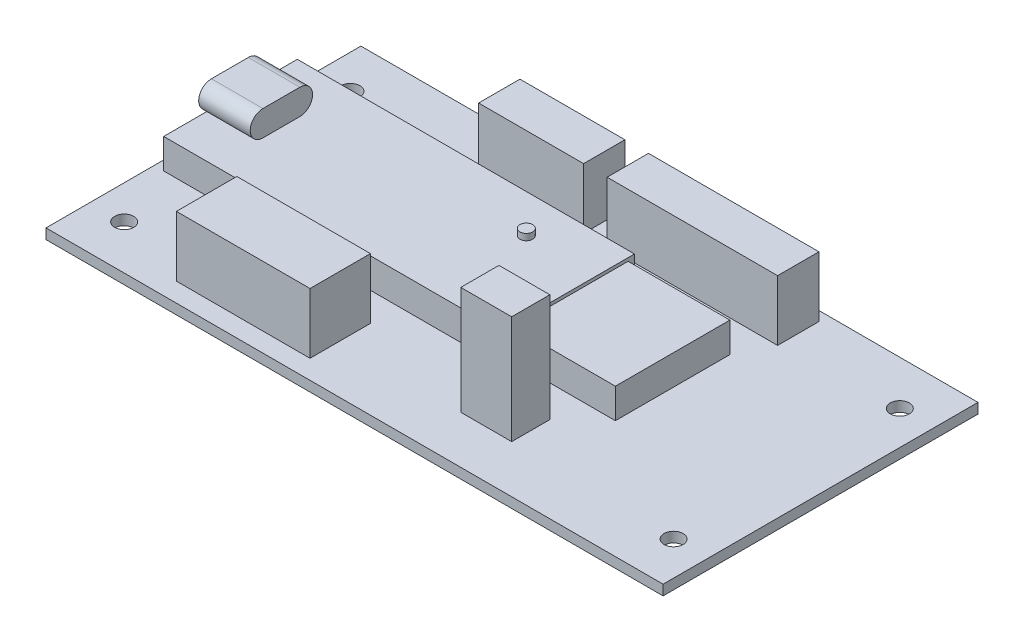
from build123d import *

# Parameters (mm, degrees)
SKETCH1_W                = 97
SKETCH1_H                = 49.5
SKETCH1_R                = 1.5
BOSS_EXTRUDE1_DEPTH      = 1.6
SKETCH2_W                = 16.5
SKETCH2_H                = 6.5
SKETCH2_W_2              = 26.8
SKETCH2_W_3              = 21
SKETCH2_H_2              = 9.5
BOSS_EXTRUDE2_DEPTH      = 9.5
SKETCH2_3_W              = 16
SKETCH2_3_H              = 18
SKETCH2_3_W_2            = 53
SKETCH2_3_H_2            = 21
BOSS_EXTRUDE3_DEPTH      = 4.7
SKETCH2_4_W              = 8
SKETCH2_4_H              = 6
BOSS_EXTRUDE4_DEPTH      = 17
SKETCH3_R                = 1
BOSS_EXTRUDE5_DEPTH      = 1
BOSS_EXTRUDE6_DEPTH      = 0.1
BOSS_EXTRUDE6_DEPTH_BACK = 8


with BuildPart() as part:
    # Sketch1 → Boss-Extrude1 (new body)
    with BuildSketch(Plane(origin=(0, 0, 0), x_dir=(1, 0, 0), z_dir=(0, 1, 0))):
        Rectangle(SKETCH1_W, SKETCH1_H)
        with Locations((-43.18, 17.78)):
            Circle(SKETCH1_R, mode=Mode.SUBTRACT)
        with Locations((-43.18, -17.78)):
            Circle(SKETCH1_R, mode=Mode.SUBTRACT)
        with Locations((43.18, 17.78)):
            Circle(SKETCH1_R, mode=Mode.SUBTRACT)
        with Locations((43.18, -17.78)):
            Circle(SKETCH1_R, mode=Mode.SUBTRACT)
    extrude(amount=BOSS_EXTRUDE1_DEPTH)

    # Sketch2 → Boss-Extrude2 (add)
    with BuildSketch(Plane(origin=(0, 1.6, 0), x_dir=(1, 0, 0), z_dir=(0, 1, 0))):
        with Locations((-13.75, 20)):
            Rectangle(SKETCH2_W, SKETCH2_H)
        with Locations((11.6, 20)):
            Rectangle(SKETCH2_W_2, SKETCH2_H)
        with Locations((-20.5, -17)):
            Rectangle(SKETCH2_W_3, SKETCH2_H_2)
    extrude(amount=BOSS_EXTRUDE2_DEPTH)

    # Sketch2<3> → Boss-Extrude3 (add)
    with BuildSketch(Plane(origin=(0, 1.6, 0), x_dir=(1, 0, 0), z_dir=(0, 1, 0))):
        with Locations((14.5, 2.75)):
            Rectangle(SKETCH2_3_W, SKETCH2_3_H)
        with Locations((-20.5, 2.75)):
            Rectangle(SKETCH2_3_W_2, SKETCH2_3_H_2)
    extrude(amount=BOSS_EXTRUDE3_DEPTH)

    # Sketch2<4> → Boss-Extrude4 (add)
    with BuildSketch(Plane(origin=(0, 1.6, 0), x_dir=(1, 0, 0), z_dir=(0, 1, 0))):
        with Locations((13.2, -14.25)):
            Rectangle(SKETCH2_4_W, SKETCH2_4_H)
    extrude(amount=BOSS_EXTRUDE4_DEPTH)

    # Sketch3 → Boss-Extrude5 (add)
    with BuildSketch(Plane(origin=(0, 6.3, 0), x_dir=(1, 0, 0), z_dir=(0, 1, 0))):
        with Locations((-5, 7.25)):
            Circle(SKETCH3_R)
    extrude(amount=BOSS_EXTRUDE5_DEPTH)

    # Sketch4 → Boss-Extrude6 (add, two sides: drawn at the far end of the back side and taken through both)
    with BuildSketch(Plane.ZY.offset(47).offset(-BOSS_EXTRUDE6_DEPTH_BACK)):
        with BuildLine():
            Line((-5.65, 10.3), (0.15, 10.3))
            ThreePointArc((0.15, 10.3), (2.15, 8.3), (0.15, 6.3))
            Line((0.15, 6.3), (-5.65, 6.3))
            ThreePointArc((-5.65, 6.3), (-7.65, 8.3), (-5.65, 10.3))
        make_face()
    extrude(amount=BOSS_EXTRUDE6_DEPTH + BOSS_EXTRUDE6_DEPTH_BACK)


solid = part.part
